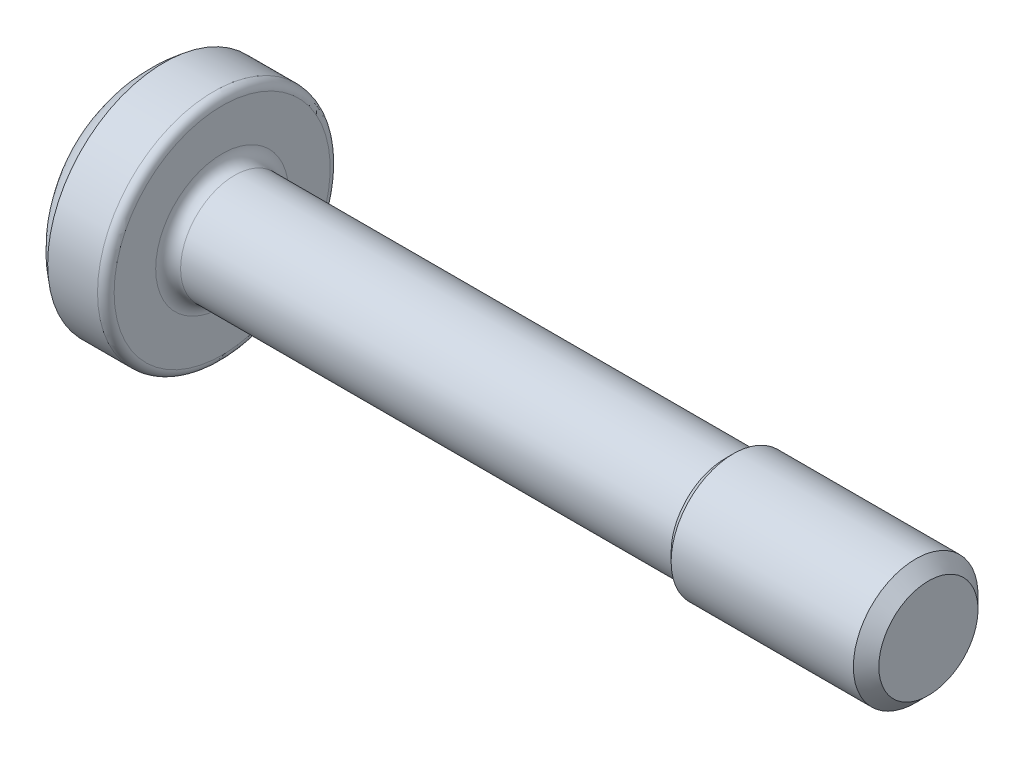
from build123d import *

# Parameters (mm, degrees)
CUT_EXTRUDE1_DEPTH = 2.1


with BuildPart() as part:
    # Sketch1 → Revolve1 (revolve)
    with BuildSketch(Plane.XY, mode=Mode.PRIVATE) as revolve1_sk:
        with BuildLine():
            Line((-2.4, 0), (-2.4, 1.4))
            ThreePointArc((-2.4, 1.4), (-2.010193737, 2.178709812), (-1.4, 2.8))
            Line((-1.4, 2.8), (-0.2, 2.8))
            ThreePointArc((-0.2, 2.8), (-0.058578644, 2.741421356), (0, 2.6))
            Line((0, 2.6), (0, 1.6))
            ThreePointArc((0, 1.6), (0.087867966, 1.387867966), (0.3, 1.3))
            Line((0.3, 1.3), (12.1065, 1.3))
            Line((12.1065, 1.3), (12.3065, 1.5))
            Line((12.3065, 1.5), (16.6935, 1.5))
            Line((16.6935, 1.5), (17, 1.1935))
            Line((17, 1.1935), (17, 0))
            Line((17, 0), (-2.4, 0))
        make_face()
    revolve(revolve1_sk.sketch.rotate(Axis((17, 0, 0), (-1, 0, 0)), 270), axis=Axis((17, 0, 0), (-1, 0, 0)))

    # Sketch2 → Cut-Extrude1 (cut)
    with BuildSketch(Plane.ZY.offset(2.4)):
        with BuildLine():
            Line((0.38, -2.014472636), (0.38, -0.975538848))
            ThreePointArc((0.38, -0.975538848), (0.613182892, -0.826946318), (0.88968299, -0.828248869))
            ThreePointArc((0.88968299, -0.828248869), (1.212435563, -0.700000005), (1.162126064, -0.356363644))
            ThreePointArc((1.162126064, -0.356363644), (1.008436863, -6e-09), (1.162126056, 0.356363636))
            ThreePointArc((1.162126056, 0.356363636), (1.212435568, 0.699999995), (0.889683001, 0.828248872))
            ThreePointArc((0.889683001, 0.828248872), (0.613182897, 0.826946316), (0.38, 0.975538848))
            Line((0.38, 0.975538848), (0.38, 2.014472636))
            ThreePointArc((0.38, 2.014472636), (0, 2.05), (-0.38, 2.014472636))
            Line((-0.38, 2.014472636), (-0.38, 0.975538848))
            ThreePointArc((-0.38, 0.975538848), (-0.613182887, 0.826946319), (-0.889682981, 0.828248866))
            ThreePointArc((-0.889682981, 0.828248866), (-1.212435565, 0.700000001), (-1.162126051, 0.356363631))
            ThreePointArc((-1.162126051, 0.356363631), (-1.008436863, -7e-09), (-1.162126061, -0.356363641))
            ThreePointArc((-1.162126061, -0.356363641), (-1.212435561, -0.700000008), (-0.889682979, -0.828248866))
            ThreePointArc((-0.889682979, -0.828248866), (-0.613182886, -0.826946319), (-0.38, -0.975538848))
            Line((-0.38, -0.975538848), (-0.38, -2.014472636))
            ThreePointArc((-0.38, -2.014472636), (0, -2.05), (0.38, -2.014472636))
        make_face()
    extrude(amount=-CUT_EXTRUDE1_DEPTH, mode=Mode.SUBTRACT)

    # Sketch3 → Cut-Revolve1 (revolve, cut)
    with BuildSketch(Plane.XY, mode=Mode.PRIVATE) as cut_revolve1_sk:
        Polygon((-2.4, 0), (-2.4, 1.4), (-1, 0), align=None)
    revolve(cut_revolve1_sk.sketch.rotate(Axis((-1, 0, 0), (-1, 0, 0)), 270), axis=Axis((-1, 0, 0), (-1, 0, 0)), mode=Mode.SUBTRACT)


solid = part.part
